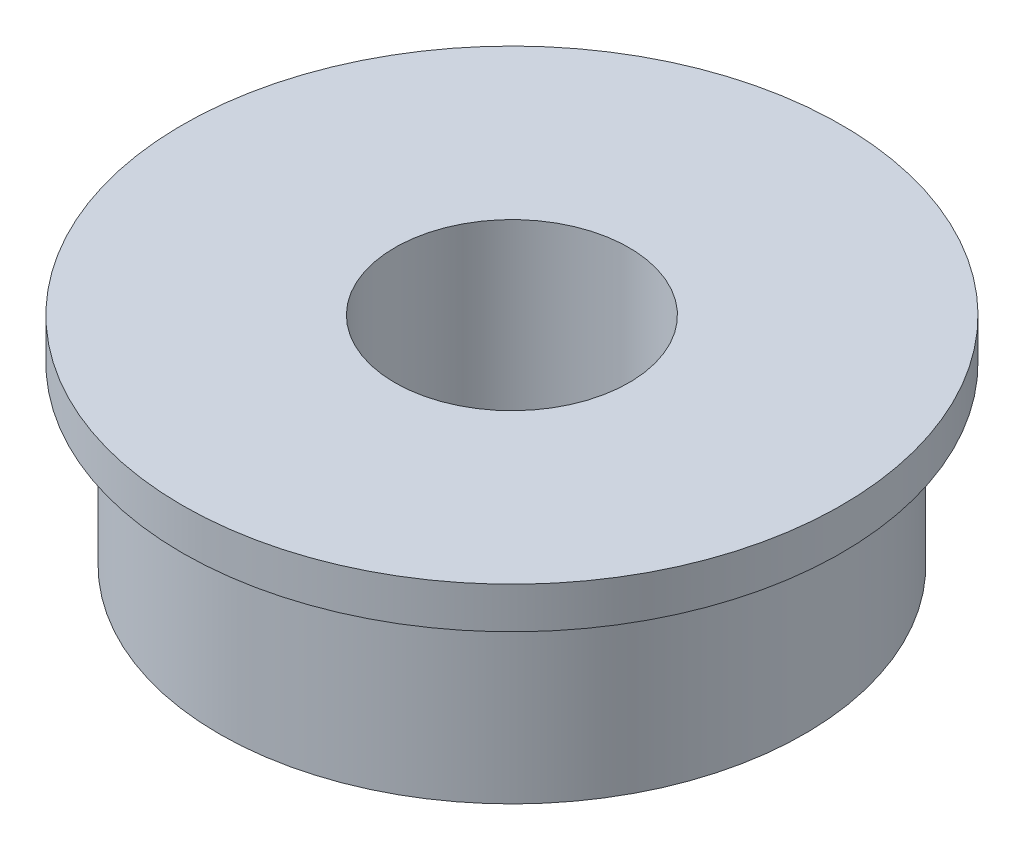
from build123d import *

# Parameters (mm, degrees)
SKETCH1_R           = 7.9375
SKETCH1_R_2         = 3.175
BOSS_EXTRUDE1_DEPTH = 4.7498
SKETCH2_R           = 8.9375
SKETCH2_R_2         = 3.175
BOSS_EXTRUDE2_DEPTH = 1.1176


with BuildPart() as part:
    # Sketch1 → Boss-Extrude1 (new body)
    with BuildSketch(Plane(origin=(0, 0, 0), x_dir=(1, 0, 0), z_dir=(0, 1, 0))):
        with Locations(Location((0, 0, 0), (0, 0, 270))):
            Circle(SKETCH1_R)
        with Locations(Location((0, 0, 0), (0, 0, 270))):
            Circle(SKETCH1_R_2, mode=Mode.SUBTRACT)
    extrude(amount=BOSS_EXTRUDE1_DEPTH)

    # Sketch2 → Boss-Extrude2 (add)
    with BuildSketch(Plane(origin=(0, 4.7498, 0), x_dir=(1, 0, 0), z_dir=(0, 1, 0))):
        with Locations(Location((0, 0, 0), (0, 0, 270))):
            Circle(SKETCH2_R)
        with Locations(Location((0, 0, 0), (0, 0, 270))):
            Circle(SKETCH2_R_2, mode=Mode.SUBTRACT)
    extrude(amount=BOSS_EXTRUDE2_DEPTH)


solid = part.part
